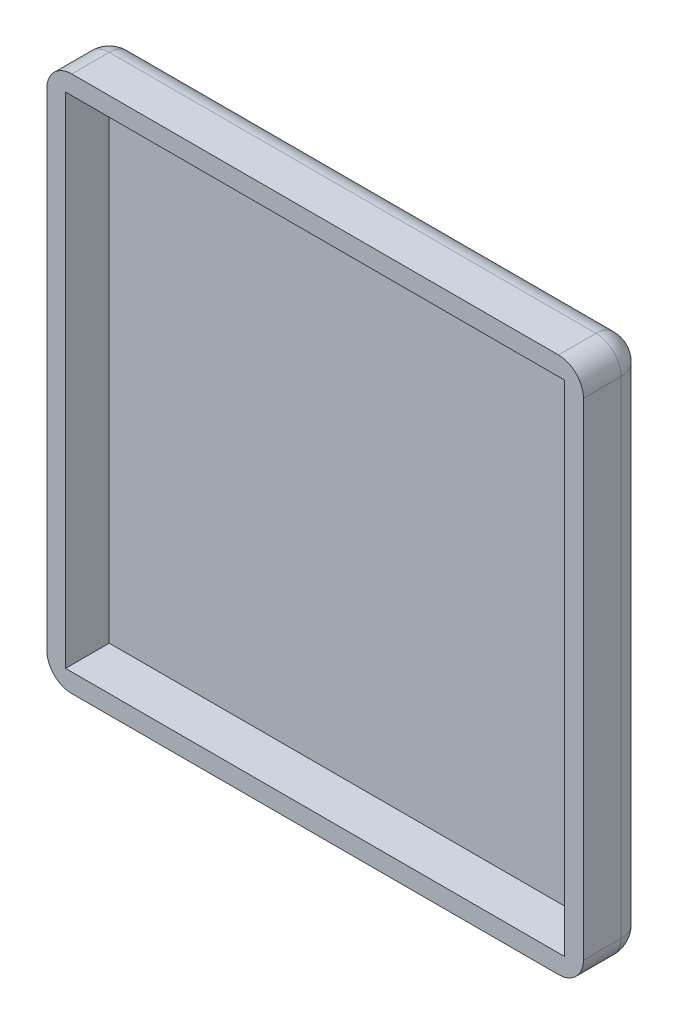
from build123d import *

# Parameters (mm, degrees)
IZIM1_W                     = 43
IZIM1_H                     = 43
Y_KSEKLIK_EKSTR_ZYON1_DEPTH = 5
IZIM2_W                     = 40
IZIM2_H                     = 40
KES_EKSTR_ZYON1_DEPTH       = 3.5
RADYUS1_R                   = 2


with BuildPart() as part:
    # Çizim1 → Yükseklik-Ekstrüzyon1 (new body)
    with BuildSketch(Plane.XY.offset(5)):
        Rectangle(IZIM1_W, IZIM1_H)
    extrude(amount=-Y_KSEKLIK_EKSTR_ZYON1_DEPTH)

    # Çizim2 → Kes-Ekstrüzyon1 (cut)
    with BuildSketch(Plane.XY.offset(5)):
        Rectangle(IZIM2_W, IZIM2_H)
    extrude(amount=-KES_EKSTR_ZYON1_DEPTH, mode=Mode.SUBTRACT)

    # Radyus1
    radyus1_edges = [part.edges().sort_by_distance(p)[0] for p in [
        (21.5, 0, 0),
        (0, 21.5, 0),
        (-21.5, 0, 0),
        (-21.5, 21.5, 2.5),
        (21.5, 21.5, 2.5),
        (21.5, -21.5, 2.5),
        (-21.5, -21.5, 2.5),
        (0, -21.5, 0),
    ]]
    fillet(radyus1_edges, radius=RADYUS1_R)


solid = part.part
